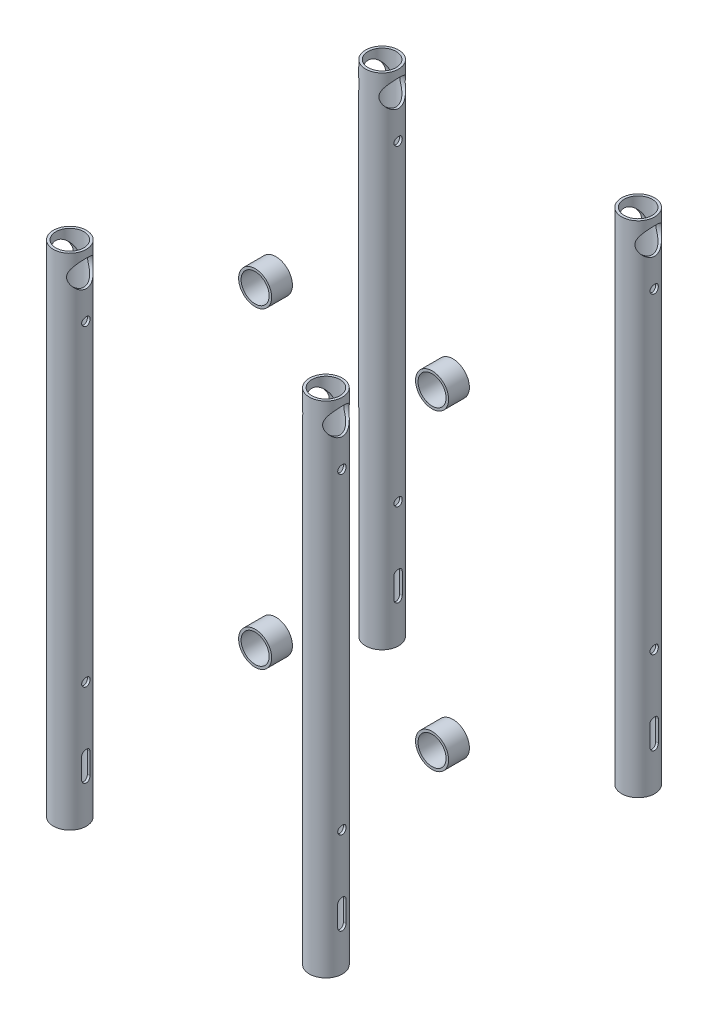
from build123d import *

# Parameters (mm, degrees)
BOSS_EXTRUDE1_DEPTH        = 30
BOSS_EXTRUDE1_DEPTH_BACK   = 450
SKETCH1_R                  = 15.875
SKETCH1_R_2                = 13.462
BOSS_EXTRUDE1_2_DEPTH      = 30
BOSS_EXTRUDE1_2_DEPTH_BACK = 450
BOSS_EXTRUDE1_3_DEPTH      = 30
BOSS_EXTRUDE1_3_DEPTH_BACK = 450
BOSS_EXTRUDE1_4_DEPTH      = 30
BOSS_EXTRUDE1_4_DEPTH_BACK = 450
CUT_EXTRUDE1_DEPTH         = 350
CUT_EXTRUDE1_DEPTH_BACK    = 350
SKETCH3_R                  = 4
SKETCH3_R_2                = 12.7
BOSS_EXTRUDE2_DEPTH        = 10
BOSS_EXTRUDE2_DEPTH_BACK   = 10
SKETCH4_R                  = 15.875
SKETCH4_R_2                = 13.462
BOSS_EXTRUDE2_2_DEPTH      = 10
BOSS_EXTRUDE2_2_DEPTH_BACK = 10
BOSS_EXTRUDE2_3_DEPTH      = 10
BOSS_EXTRUDE2_3_DEPTH_BACK = 10
BOSS_EXTRUDE2_4_DEPTH      = 10
BOSS_EXTRUDE2_4_DEPTH_BACK = 10


with BuildPart() as part:
    # Sketch1 → Boss-Extrude1 (new, two sides: drawn at the far end of the back side and taken through both)
    with BuildSketch(Plane(origin=(0, 0, 0), x_dir=(1, 0, 0), z_dir=(0, 1, 0)).offset(-BOSS_EXTRUDE1_DEPTH_BACK)):
        with Locations((-123, 150)):
            Circle(SKETCH1_R)
        with Locations((-123, 150)):
            Circle(SKETCH1_R_2, mode=Mode.SUBTRACT)
    extrude(amount=BOSS_EXTRUDE1_DEPTH + BOSS_EXTRUDE1_DEPTH_BACK)


with BuildPart() as body_2:
    # Sketch1 → Boss-Extrude1 2 (new, two sides: drawn at the far end of the back side and taken through both)
    with BuildSketch(Plane(origin=(0, 0, 0), x_dir=(1, 0, 0), z_dir=(0, 1, 0)).offset(-BOSS_EXTRUDE1_2_DEPTH_BACK)):
        with Locations((123, 150)):
            Circle(SKETCH1_R)
        with Locations((123, 150)):
            Circle(SKETCH1_R_2, mode=Mode.SUBTRACT)
    extrude(amount=BOSS_EXTRUDE1_2_DEPTH + BOSS_EXTRUDE1_2_DEPTH_BACK)


with BuildPart() as body_3:
    # Sketch1 → Boss-Extrude1 3 (new, two sides: drawn at the far end of the back side and taken through both)
    with BuildSketch(Plane(origin=(0, 0, 0), x_dir=(1, 0, 0), z_dir=(0, 1, 0)).offset(-BOSS_EXTRUDE1_3_DEPTH_BACK)):
        with Locations((123, -150)):
            Circle(SKETCH1_R)
        with Locations((123, -150)):
            Circle(SKETCH1_R_2, mode=Mode.SUBTRACT)
    extrude(amount=BOSS_EXTRUDE1_3_DEPTH + BOSS_EXTRUDE1_3_DEPTH_BACK)


with BuildPart() as body_4:
    # Sketch1 → Boss-Extrude1 4 (new, two sides: drawn at the far end of the back side and taken through both)
    with BuildSketch(Plane(origin=(0, 0, 0), x_dir=(1, 0, 0), z_dir=(0, 1, 0)).offset(-BOSS_EXTRUDE1_4_DEPTH_BACK)):
        with Locations((-123, -150)):
            Circle(SKETCH1_R)
        with Locations((-123, -150)):
            Circle(SKETCH1_R_2, mode=Mode.SUBTRACT)
    extrude(amount=BOSS_EXTRUDE1_4_DEPTH + BOSS_EXTRUDE1_4_DEPTH_BACK)


with BuildPart() as cut_extrude1_tool:
    # Sketch3 → Cut-Extrude1 (new, two sides: drawn at the far end of the back side and taken through both)
    with BuildSketch(Plane(origin=(0, 0, 0), x_dir=(0, 0, -1), z_dir=(1, 0, 0)).offset(-CUT_EXTRUDE1_DEPTH_BACK)):
        with Locations((-150, -30)):
            Circle(SKETCH3_R)
        with Locations((150, -30)):
            Circle(SKETCH3_R)
        with Locations((-150, -330)):
            Circle(SKETCH3_R)
        with Locations((150, -330)):
            Circle(SKETCH3_R)
        with Locations((-150, 10)):
            Circle(SKETCH3_R_2)
        with Locations((150, 10)):
            Circle(SKETCH3_R_2)
        with BuildLine():
            Line((-154, -410), (-154, -390))
            ThreePointArc((-154, -390), (-150, -386), (-146, -390))
            Line((-146, -390), (-146, -410))
            ThreePointArc((-146, -410), (-150, -414), (-154, -410))
        make_face()
        with BuildLine():
            Line((146, -410), (146, -390))
            ThreePointArc((146, -390), (150, -386), (154, -390))
            Line((154, -390), (154, -410))
            ThreePointArc((154, -410), (150, -414), (146, -410))
        make_face()
    extrude(amount=CUT_EXTRUDE1_DEPTH + CUT_EXTRUDE1_DEPTH_BACK)


with BuildPart() as part_1:
    add(part.part)

    # Cut-Extrude1: cut by cut_extrude1_tool
    add(cut_extrude1_tool.part, mode=Mode.SUBTRACT)


with BuildPart() as body_2_1:
    add(body_2.part)

    # Cut-Extrude1: cut by cut_extrude1_tool
    add(cut_extrude1_tool.part, mode=Mode.SUBTRACT)


with BuildPart() as body_3_1:
    add(body_3.part)

    # Cut-Extrude1: cut by cut_extrude1_tool
    add(cut_extrude1_tool.part, mode=Mode.SUBTRACT)


with BuildPart() as body_4_1:
    add(body_4.part)

    # Cut-Extrude1: cut by cut_extrude1_tool
    add(cut_extrude1_tool.part, mode=Mode.SUBTRACT)


with BuildPart() as body_5:
    # Sketch4 → Boss-Extrude2 (new, two sides: drawn at the far end of the back side and taken through both)
    with BuildSketch(Plane.XY.offset(-BOSS_EXTRUDE2_DEPTH_BACK)):
        with Locations((-85, -60.875)):
            Circle(SKETCH4_R)
        with Locations((-85, -60.875)):
            Circle(SKETCH4_R_2, mode=Mode.SUBTRACT)
    extrude(amount=BOSS_EXTRUDE2_DEPTH + BOSS_EXTRUDE2_DEPTH_BACK)


with BuildPart() as body_6:
    # Sketch4 → Boss-Extrude2 2 (new, two sides: drawn at the far end of the back side and taken through both)
    with BuildSketch(Plane.XY.offset(-BOSS_EXTRUDE2_2_DEPTH_BACK)):
        with Locations((85, -60.875)):
            Circle(SKETCH4_R)
        with Locations((85, -60.875)):
            Circle(SKETCH4_R_2, mode=Mode.SUBTRACT)
    extrude(amount=BOSS_EXTRUDE2_2_DEPTH + BOSS_EXTRUDE2_2_DEPTH_BACK)


with BuildPart() as body_7:
    # Sketch4 → Boss-Extrude2 3 (new, two sides: drawn at the far end of the back side and taken through both)
    with BuildSketch(Plane.XY.offset(-BOSS_EXTRUDE2_3_DEPTH_BACK)):
        with Locations((-85, -360.875)):
            Circle(SKETCH4_R)
        with Locations((-85, -360.875)):
            Circle(SKETCH4_R_2, mode=Mode.SUBTRACT)
    extrude(amount=BOSS_EXTRUDE2_3_DEPTH + BOSS_EXTRUDE2_3_DEPTH_BACK)


with BuildPart() as body_8:
    # Sketch4 → Boss-Extrude2 4 (new, two sides: drawn at the far end of the back side and taken through both)
    with BuildSketch(Plane.XY.offset(-BOSS_EXTRUDE2_4_DEPTH_BACK)):
        with Locations((85, -360.875)):
            Circle(SKETCH4_R)
        with Locations((85, -360.875)):
            Circle(SKETCH4_R_2, mode=Mode.SUBTRACT)
    extrude(amount=BOSS_EXTRUDE2_4_DEPTH + BOSS_EXTRUDE2_4_DEPTH_BACK)


solid = Compound([part_1.part, body_2_1.part, body_3_1.part, body_4_1.part, body_5.part, body_6.part, body_7.part, body_8.part])
